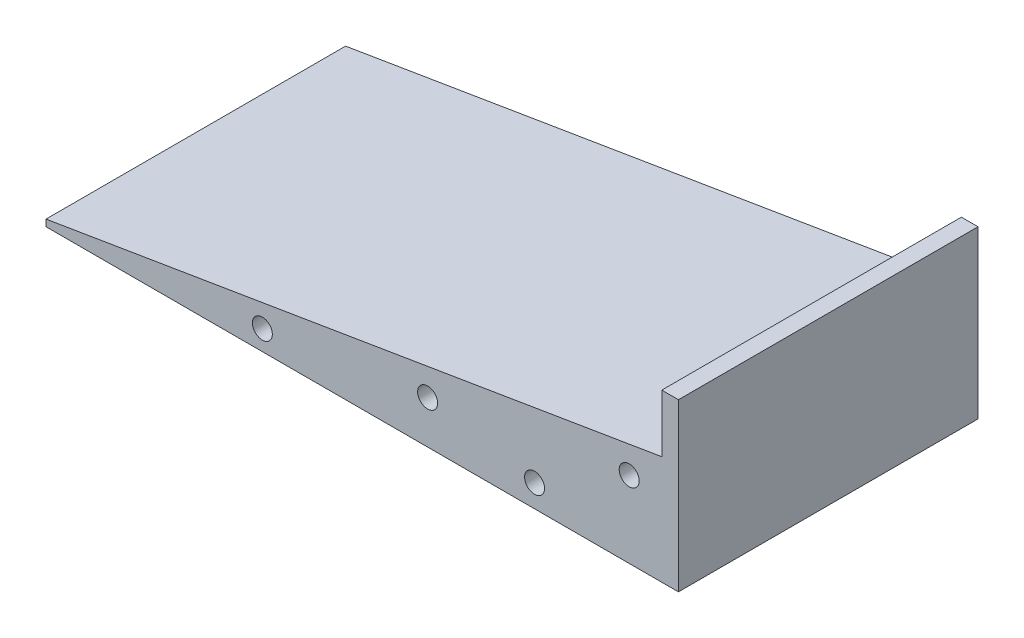
from build123d import *

# Parameters (mm, degrees)
ESQUISSE1_R             = 3
BOSS_EXTRU_1_DEPTH      = 200
ESQUISSE4_W             = 5
ESQUISSE4_H             = 50
BOSS_EXTRU_4_DEPTH      = 180
BOSS_EXTRU_7_DEPTH      = 50
ESQUISSE6_W             = 20
ESQUISSE6_H             = 10.719834163
ENL_V_MAT_EXTRU_2_DEPTH = 10
ESQUISSE5_W             = 10
ESQUISSE5_H             = 10
ENL_V_MAT_EXTRU_1_DEPTH = 10
ESQUISSE14_R            = 5
ENL_V_MAT_EXTRU_4_DEPTH = 15
BOSS_EXTRU_8_REACH      = 242.401
ENL_V_MAT_EXTRU_5_REACH = 238.046
ESQUISSE16_W            = 190
ESQUISSE16_H            = 60


with BuildPart() as part:
    # Esquisse1 → Boss.-Extru.1 (new body)
    with BuildSketch(Plane.XY):
        Polygon((-105.796013405, 0), (84.203986595, 0), (84.203986595, 33.502126335), (-105.796013405, 2), align=None)
        with Locations((69.406004871, 22.939397164)):
            Circle(ESQUISSE1_R, mode=Mode.SUBTRACT)
        with Locations((40.981469067, 6.77616521)):
            Circle(ESQUISSE1_R, mode=Mode.SUBTRACT)
        with Locations((-40.796013405, 6)):
            Circle(ESQUISSE1_R, mode=Mode.SUBTRACT)
        with Locations((8.861542866, 12.901085106)):
            Circle(ESQUISSE1_R, mode=Mode.SUBTRACT)
    extrude(amount=BOSS_EXTRU_1_DEPTH)

    # Esquisse4 → Boss.-Extru.4 (add)
    with BuildSketch(Plane(origin=(84.203986595, 0, 0), x_dir=(0, 0, -1), z_dir=(1, 0, 0))):
        with Locations((-202.5, 25)):
            Rectangle(ESQUISSE4_W, ESQUISSE4_H)
        with Locations((2.5, 25)):
            Rectangle(ESQUISSE4_W, ESQUISSE4_H)
    extrude(amount=-BOSS_EXTRU_4_DEPTH)

    # Esquisse8 → Boss.-Extru.7 (add)
    with BuildSketch(Plane(origin=(0, 50, 0), x_dir=(1, 0, 0), z_dir=(0, 1, 0))):
        Polygon((84.203986595, 0), (-95.796013405, 0), (-95.796013405, -5), align=None)
    boss_extru_7 = extrude(amount=-BOSS_EXTRU_7_DEPTH)

    # Esquisse6 → Enlèv. mat.-Extru.2 (cut)
    with BuildSketch(Plane(origin=(0, 0, -5), x_dir=(-1, 0, 0), z_dir=(0, 0, -1))):
        with Locations((95.796013405, 5.359917081)):
            Rectangle(ESQUISSE6_W, ESQUISSE6_H)
    enl_v_mat_extru_2 = extrude(amount=-ENL_V_MAT_EXTRU_2_DEPTH, mode=Mode.SUBTRACT)

    # Esquisse5 → Enlèv. mat.-Extru.1 (cut)
    with BuildSketch(Plane(origin=(84.203986595, 0, 0), x_dir=(0, 0, -1), z_dir=(1, 0, 0))):
        with Locations((-200, 5)):
            Rectangle(ESQUISSE5_W, ESQUISSE5_H)
        with Locations((0, 5)):
            Rectangle(ESQUISSE5_W, ESQUISSE5_H)
    extrude(amount=-ENL_V_MAT_EXTRU_1_DEPTH, mode=Mode.SUBTRACT)

    # Esquisse14 → Enlèv. mat.-Extru.4 (cut)
    with BuildSketch(Plane(origin=(0, 0, -5), x_dir=(-1, 0, 0), z_dir=(0, 0, -1))):
        with Locations((-69.406004871, 22.939397164)):
            Circle(ESQUISSE14_R)
        with Locations((-40.981469067, 6.77616521)):
            Circle(ESQUISSE14_R)
        with Locations((-8.861542866, 12.901085106)):
            Circle(ESQUISSE14_R)
        with Locations((40.796013405, 6)):
            Circle(ESQUISSE14_R)
    enl_v_mat_extru_4 = extrude(amount=-ENL_V_MAT_EXTRU_4_DEPTH, mode=Mode.SUBTRACT)

    # Symétrie3: Boss.-Extru.7, Enlèv. mat.-Extru.2, Enlèv. mat.-Extru.4 across plane
    add(boss_extru_7.mirror(Plane(origin=(0, 0, 100), x_dir=(1, 0, 0), z_dir=(0, 0, -1))))
    add(enl_v_mat_extru_2.mirror(Plane(origin=(0, 0, 100), x_dir=(1, 0, 0), z_dir=(0, 0, -1))), mode=Mode.SUBTRACT)
    add(enl_v_mat_extru_4.mirror(Plane(origin=(0, 0, 100), x_dir=(1, 0, 0), z_dir=(0, 0, -1))), mode=Mode.SUBTRACT)

    # Boss.-Extru.8: up to this plane
    boss_extru_8_end = Plane(origin=(-95.796013405, -180.069431054, 195), z_dir=(-0.0277670672403533, 0, 0.9996144206527183))
    # Esquisse15 → Boss.-Extru.8 (add, up to the surface)
    with BuildSketch(Plane(origin=(0, 0, -5), x_dir=(-1, 0, 0), z_dir=(0, 0, -1)), mode=Mode.PRIVATE) as boss_extru_8_sk1:
        Polygon((-84.203986595, 33.502126335), (-79.203986595, 32.67312301), (-79.203986595, 50), (-84.203986595, 50), align=None)
    boss_extru_8_tool1 = split(extrude(boss_extru_8_sk1.sketch, amount=-BOSS_EXTRU_8_REACH, mode=Mode.PRIVATE), bisect_by=boss_extru_8_end, keep=Keep.BOTH, mode=Mode.PRIVATE)
    add(boss_extru_8_tool1.solids().sort_by_distance((81.683563, 41.542119, -5))[0])

    # Enlèv. mat.-Extru.5: up to this face of the body (flat: up to its plane)
    enl_v_mat_extru_5_end = Plane(part.part.faces().sort_by_distance((-10.38578146, 0, 100.003530671))[0])
    # Esquisse16 → Enlèv. mat.-Extru.5 (cut, up to the picked face)
    with BuildSketch(Plane(origin=(0, 50, 0), x_dir=(1, 0, 0), z_dir=(0, 1, 0)), mode=Mode.PRIVATE) as enl_v_mat_extru_5_sk1:
        with Locations((-10.796013405, -175)):
            Rectangle(ESQUISSE16_W, ESQUISSE16_H)
    enl_v_mat_extru_5_tool1 = split(extrude(enl_v_mat_extru_5_sk1.sketch, amount=-ENL_V_MAT_EXTRU_5_REACH, mode=Mode.PRIVATE), bisect_by=enl_v_mat_extru_5_end, keep=Keep.BOTH, mode=Mode.PRIVATE)
    # Esquisse16 → Enlèv. mat.-Extru.5 (cut, up to the picked face)
    with BuildSketch(Plane(origin=(0, 50, 0), x_dir=(1, 0, 0), z_dir=(0, 1, 0)), mode=Mode.PRIVATE) as enl_v_mat_extru_5_sk2:
        with Locations((-10.796013405, -25)):
            Rectangle(ESQUISSE16_W, ESQUISSE16_H)
    enl_v_mat_extru_5_tool2 = split(extrude(enl_v_mat_extru_5_sk2.sketch, amount=-ENL_V_MAT_EXTRU_5_REACH, mode=Mode.PRIVATE), bisect_by=enl_v_mat_extru_5_end, keep=Keep.BOTH, mode=Mode.PRIVATE)
    add(enl_v_mat_extru_5_tool1.solids().sort_by(Axis((-10.796013, 50, 175), (0, -1, 0)))[0], mode=Mode.SUBTRACT)
    add(enl_v_mat_extru_5_tool2.solids().sort_by(Axis((-10.796013, 50, 25), (0, -1, 0)))[0], mode=Mode.SUBTRACT)


solid = part.part
